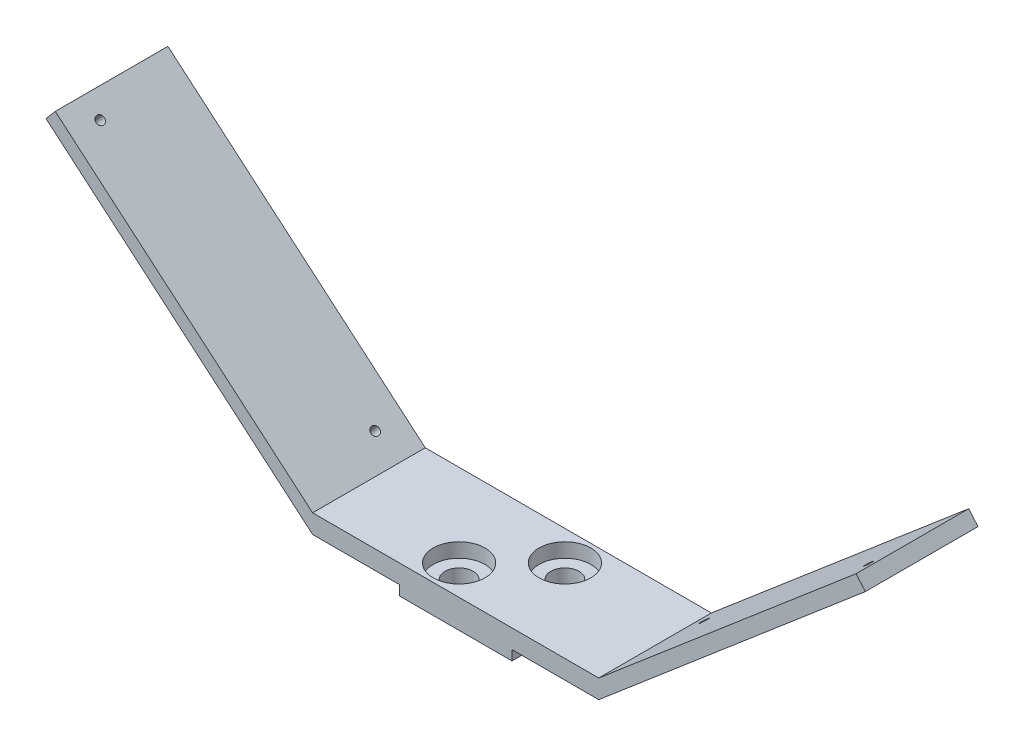
from build123d import *

# Parameters (mm, degrees)
SKETCH1_W           = 20
SKETCH1_H           = 20
SKETCH1_R           = 2.5
BOSS_EXTRUDE1_DEPTH = 2.54
SKETCH2_W           = 15.4
SKETCH2_H           = 20
SKETCH2_W_2         = 20
SKETCH2_R           = 4.6
BOSS_EXTRUDE2_DEPTH = 2.54
BOSS_EXTRUDE3_DEPTH = 20
SKETCH4_R           = 0.75
CUT_EXTRUDE1_DEPTH  = 257.103477181


with BuildPart() as part:
    # Sketch1 → Boss-Extrude1 (new body)
    with BuildSketch(Plane(origin=(0, 0, 0), x_dir=(1, 0, 0), z_dir=(0, 1, 0))):
        Rectangle(SKETCH1_W, SKETCH1_H)
        with Locations(Location((4.696699141, 4.696699141, 0), (0, 0, 270))):
            Circle(SKETCH1_R, mode=Mode.SUBTRACT)
        with Locations(Location((-4.696699141, -4.696699141, 0), (0, 0, 270))):
            Circle(SKETCH1_R, mode=Mode.SUBTRACT)
    extrude(amount=BOSS_EXTRUDE1_DEPTH)

    # Sketch2 → Boss-Extrude2 (add)
    # profile 1 of 3: a face of its own
    with BuildSketch(Plane(origin=(0, 2.54, 0), x_dir=(1, 0, 0), z_dir=(0, 1, 0))):
        with Locations((-17.7, 0)):
            Rectangle(SKETCH2_W, SKETCH2_H)
    # profile 2 of 3: a face of its own
    with BuildSketch(Plane(origin=(0, 2.54, 0), x_dir=(1, 0, 0), z_dir=(0, 1, 0))):
        Rectangle(SKETCH2_W_2, SKETCH2_H)
        with Locations(Location((-4.696699141, -4.696699141, 0), (0, 0, 270))):
            Circle(SKETCH2_R, mode=Mode.SUBTRACT)
        with Locations(Location((4.696699141, 4.696699141, 0), (0, 0, 270))):
            Circle(SKETCH2_R, mode=Mode.SUBTRACT)
    # profile 3 of 3: a face of its own
    with BuildSketch(Plane(origin=(0, 2.54, 0), x_dir=(1, 0, 0), z_dir=(0, 1, 0))):
        with Locations((17.7, 0)):
            Rectangle(SKETCH2_W, SKETCH2_H)
    extrude(amount=BOSS_EXTRUDE2_DEPTH)

    # Sketch3 → Boss-Extrude3 (add)
    with BuildSketch(Plane.XY.offset(10)):
        Polygon((-25.4, 2.54), (-25.4, 5.08), (-71.094747123, 43.964316702), (-72.740849863, 42.02990574), (-25.4, 1.744824524), (-10, 1.744824524), (-10, 2.54), align=None)
        Polygon((71.094747123, 43.964316702), (25.4, 5.08), (25.4, 2.54), (10, 2.54), (10, 1.744824524), (25.4, 1.744824524), (72.740849863, 42.02990574), align=None)
    extrude(amount=-BOSS_EXTRUDE3_DEPTH)

    # Sketch4 → Cut-Extrude1 (cut)
    with BuildSketch(Plane(origin=(-8.160655098, -9.589960753, 0), x_dir=(0.7615791187140926, -0.6480719450328537, 0), z_dir=(0.6480719450328537, 0.7615791187140926, 0))):
        with Locations(Location((-27.636315096, 4.9, 0), (0, 0, 180))):
            Circle(SKETCH4_R)
        with Locations(Location((-78.836315096, -4.9, 0), (0, 0, 180))):
            Circle(SKETCH4_R)
    cut_extrude1 = extrude(amount=-CUT_EXTRUDE1_DEPTH, mode=Mode.SUBTRACT)

    # Mirror1: Cut-Extrude1 across plane
    add(cut_extrude1.mirror(Plane(origin=(0, 0, 0), x_dir=(0, 0, 1), z_dir=(1, 0, 0))), mode=Mode.SUBTRACT)


solid = part.part
